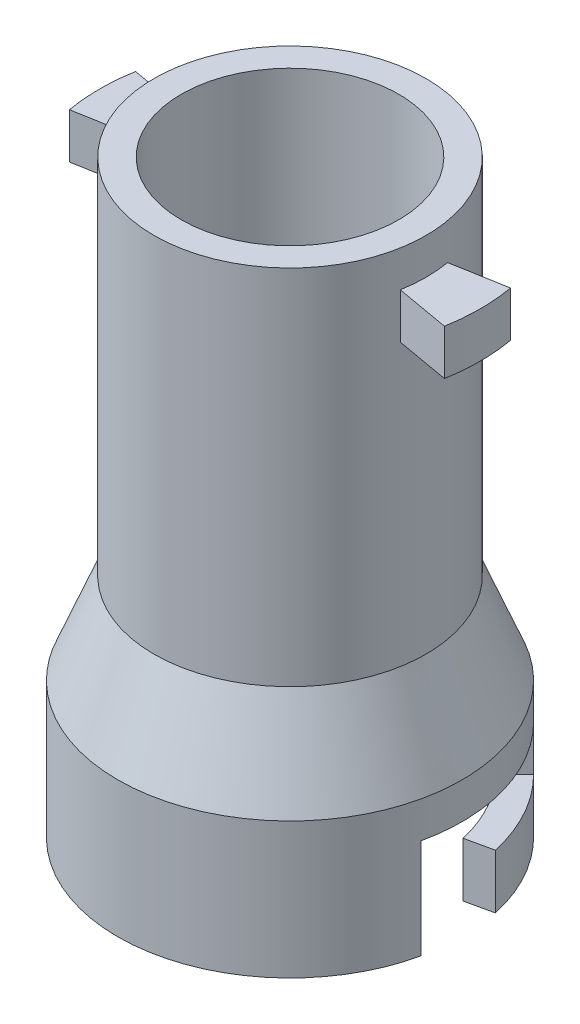
from build123d import *

# Parameters (mm, degrees)
SKETCH2_W          = 6
SKETCH2_H          = 5
REVOLVE2_ANGLE     = 20
SKETCH3_W          = 3
SKETCH3_H          = 10
SKETCH3_H_2        = 11
CUT_REVOLVE1_ANGLE = 25
SKETCH4_W          = 3
SKETCH4_H          = 5
SKETCH4_H_2        = 4
CUT_REVOLVE2_ANGLE = 45


with BuildPart() as part:
    # Sketch1 → Revolve1 (revolve)
    with BuildSketch(Plane.XY, mode=Mode.PRIVATE) as revolve1_sk:
        Polygon((12, 32), (12, -18), (16, -18), (16, -33), (19, -33), (19, -18), (15, -8), (15, 32), align=None)
    revolve(revolve1_sk.sketch.rotate(Axis((0, 40.467735012, 0), (0, -1, 0)), 90), axis=Axis((0, 40.467735012, 0), (0, -1, 0)))

    # Sketch2 → Revolve2 (revolve, symmetric)
    with BuildSketch(Plane.XY) as revolve2_sk:
        with Locations((18, 25.5)):
            Rectangle(SKETCH2_W, SKETCH2_H)
        with Locations((-18, 25.5)):
            Rectangle(SKETCH2_W, SKETCH2_H)
    revolve(axis=Axis((0, 45.306661743, 0), (0, -1, 0)), revolution_arc=REVOLVE2_ANGLE / 2)
    revolve(revolve2_sk.sketch, axis=Axis((0, 45.306661743, 0), (0, 1, 0)), revolution_arc=REVOLVE2_ANGLE / 2)

    # Sketch3 → Cut-Revolve1 (revolve, symmetric, cut)
    with BuildSketch(Plane.XY) as cut_revolve1_sk:
        with Locations((-17.5, -28)):
            Rectangle(SKETCH3_W, SKETCH3_H)
        with Locations((17.5, -27.5)):
            Rectangle(SKETCH3_W, SKETCH3_H_2)
    revolve(axis=Axis((0, -11.020729768, 0), (0, -1, 0)), revolution_arc=CUT_REVOLVE1_ANGLE / 2, mode=Mode.SUBTRACT)
    revolve(cut_revolve1_sk.sketch, axis=Axis((0, -11.020729768, 0), (0, 1, 0)), revolution_arc=CUT_REVOLVE1_ANGLE / 2, mode=Mode.SUBTRACT)

    # Sketch4 → Cut-Revolve2 (revolve, cut)
    with BuildSketch(Plane.XY):
        with Locations((17.5, -24.5)):
            Rectangle(SKETCH4_W, SKETCH4_H)
        with Locations((-17.5, -25)):
            Rectangle(SKETCH4_W, SKETCH4_H_2)
    revolve(axis=Axis((0, -42.004114959, 0), (0, 1, 0)), revolution_arc=CUT_REVOLVE2_ANGLE, mode=Mode.SUBTRACT)


solid = part.part
